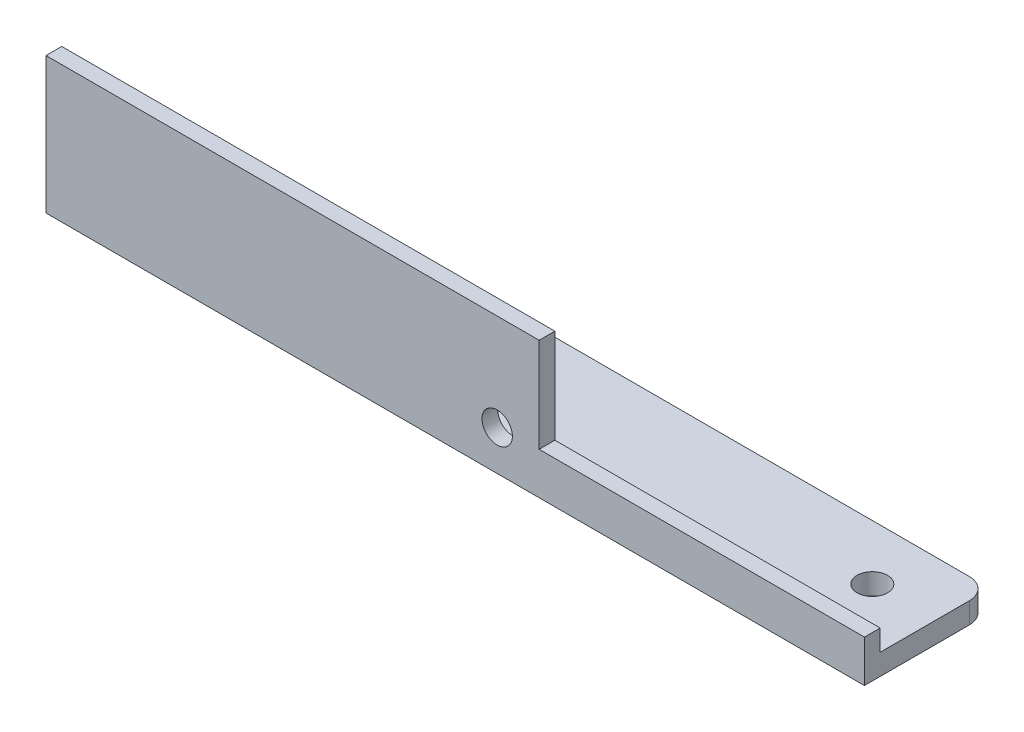
from build123d import *

# Parameters (mm, degrees)
ESQUISSE1_W             = 78
ESQUISSE1_H             = 13
BOSS_EXTRU_1_DEPTH      = 12
ESQUISSE2_W             = 78
ESQUISSE2_H             = 10.5
ENL_V_MAT_EXTRU_1_DEPTH = 11
D_GAGEMENT_M2_51_D      = 2.9
ESQUISSE5_W             = 31
ESQUISSE5_H             = 9
ENL_V_MAT_EXTRU_2_DEPTH = 41.908434338
D_GAGEMENT_M2_52_D      = 2.9
D_GAGEMENT_M2_52_DEPTH  = 24
D_GAGEMENT_M2_52_TIP    = 0.871247898
CONG_1_R                = 2


with BuildPart() as part:
    # Esquisse1 → Boss.-Extru.1 (new body)
    with BuildSketch(Plane.XY):
        Rectangle(ESQUISSE1_W, ESQUISSE1_H)
    extrude(amount=BOSS_EXTRU_1_DEPTH)

    # Esquisse2 → Enlèv. mat.-Extru.1 (cut)
    with BuildSketch(Plane(origin=(0, 6.5, 0), x_dir=(1, 0, 0), z_dir=(0, 1, 0))):
        with Locations((0, -5.25)):
            Rectangle(ESQUISSE2_W, ESQUISSE2_H)
    extrude(amount=-ENL_V_MAT_EXTRU_1_DEPTH, mode=Mode.SUBTRACT)

    # Dégagement M2.51 (through all)
    with Locations(Plane(origin=(0, -4.5, 0), x_dir=(1, 0, 0), z_dir=(0, 1, 0))):
        with Locations((33, -5.25), (-35, -5.25)):
            Hole(D_GAGEMENT_M2_51_D / 2)

    # Esquisse5 → Enlèv. mat.-Extru.2 (cut, through all)
    with BuildSketch(Plane(origin=(0, 0, 10.5), x_dir=(-1, 0, 0), z_dir=(0, 0, -1))):
        with Locations((-23.5, 2)):
            Rectangle(ESQUISSE5_W, ESQUISSE5_H)
    extrude(amount=-ENL_V_MAT_EXTRU_2_DEPTH, mode=Mode.SUBTRACT)

    # Dégagement M2.52
    with Locations(Plane.XY.offset(12)):
        with Locations((4, -2.7)):
            Hole(D_GAGEMENT_M2_52_D / 2, depth=D_GAGEMENT_M2_52_DEPTH)
            with Locations((0, 0, -(D_GAGEMENT_M2_52_DEPTH + D_GAGEMENT_M2_52_TIP / 2))):  # 118° drill point
                Cone(0, D_GAGEMENT_M2_52_D / 2, D_GAGEMENT_M2_52_TIP, mode=Mode.SUBTRACT)

    # Congé1
    cong_1_edges = [part.edges().sort_by_distance(p)[0] for p in [
        (39, -5.5, 0),
    ]]
    fillet(cong_1_edges, radius=CONG_1_R)


solid = part.part
